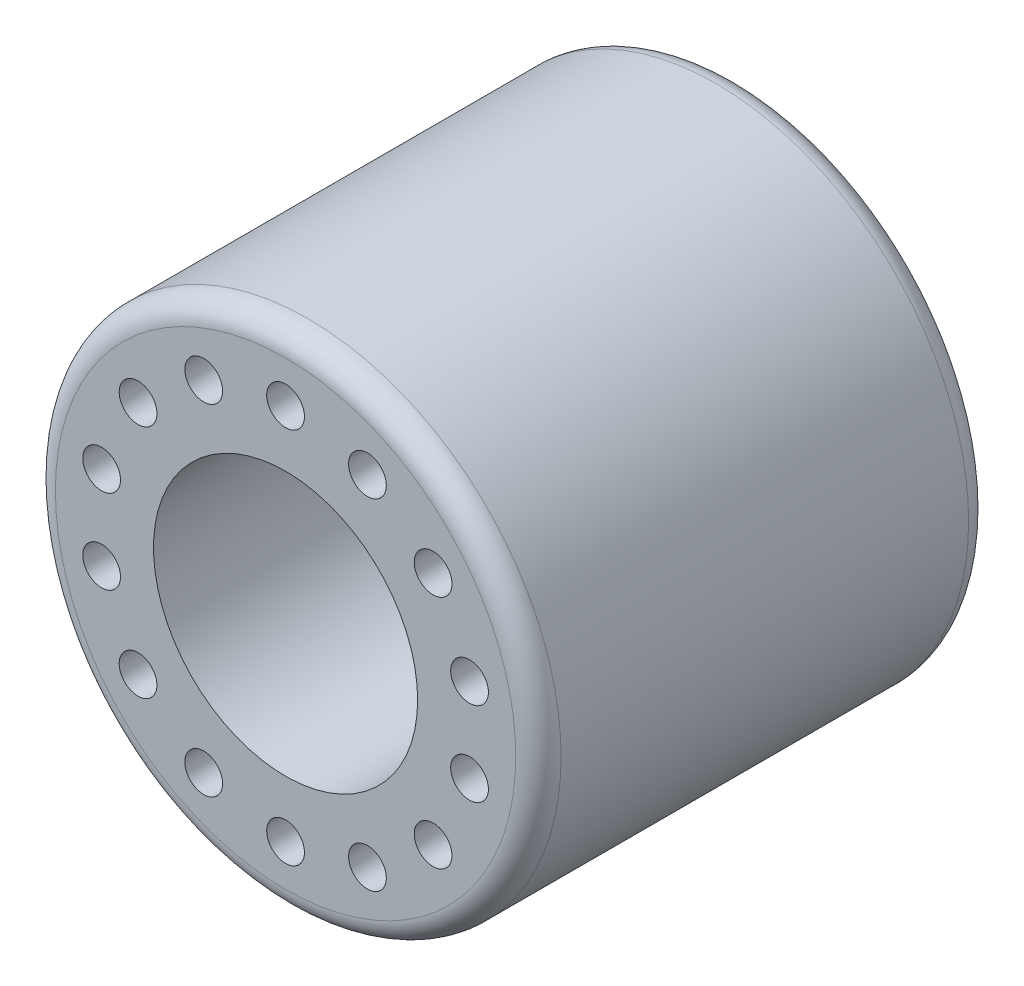
from build123d import *

# Parameters (mm, degrees)
SKETCH1_R           = 8.509
SKETCH1_R_2         = 4.445
BOSS_EXTRUDE1_DEPTH = 15.24
FILLET1_R           = 0.762
SKETCH2_R           = 0.635
CUT_EXTRUDE1_DEPTH  = 1.27


with BuildPart() as part:
    # Sketch1 → Boss-Extrude1 (new body)
    with BuildSketch(Plane.XY):
        Circle(SKETCH1_R)
        Circle(SKETCH1_R_2, mode=Mode.SUBTRACT)
    extrude(amount=BOSS_EXTRUDE1_DEPTH)

    # Fillet1
    fillet1_edges = [part.edges().sort_by_distance(p)[0] for p in [
        (-8.509, 0, 0),
        (-8.509, 0, 15.24),
    ]]
    fillet(fillet1_edges, radius=FILLET1_R)

    # Sketch2 → Cut-Extrude1 (cut)
    with BuildSketch(Plane.XY.offset(15.24)):
        with Locations((0, 6.35)):
            Circle(SKETCH2_R)
        with Locations((2.755161743, 5.721152311)):
            Circle(SKETCH2_R)
        with Locations((4.964629914, 3.959160242)):
            Circle(SKETCH2_R)
        with Locations((6.190792242, 1.413007931)):
            Circle(SKETCH2_R)
        with Locations((6.190792242, -1.413007931)):
            Circle(SKETCH2_R)
        with Locations((4.964629914, -3.959160242)):
            Circle(SKETCH2_R)
        with Locations((2.755161743, -5.721152311)):
            Circle(SKETCH2_R)
        with Locations((0, -6.35)):
            Circle(SKETCH2_R)
        with Locations((-2.755161743, -5.721152311)):
            Circle(SKETCH2_R)
        with Locations((-4.964629914, -3.959160242)):
            Circle(SKETCH2_R)
        with Locations((-6.190792242, -1.413007931)):
            Circle(SKETCH2_R)
        with Locations((-6.190792242, 1.413007931)):
            Circle(SKETCH2_R)
        with Locations((-4.964629914, 3.959160242)):
            Circle(SKETCH2_R)
        with Locations((-2.755161743, 5.721152311)):
            Circle(SKETCH2_R)
    extrude(amount=-CUT_EXTRUDE1_DEPTH, mode=Mode.SUBTRACT)


solid = part.part
